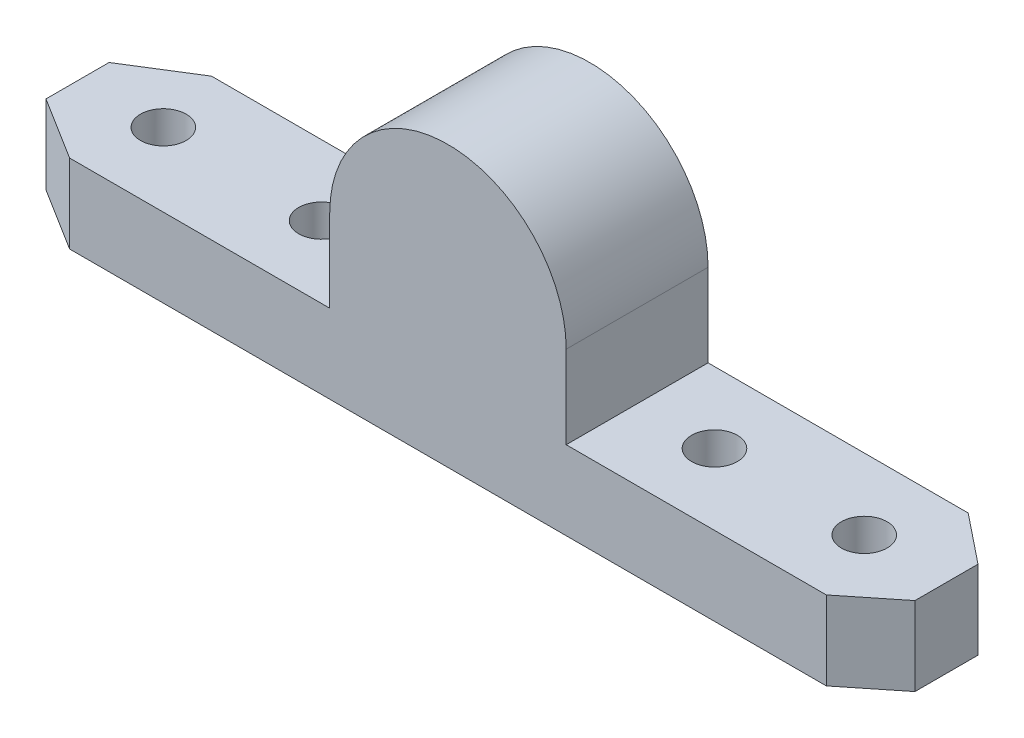
from build123d import *

# Parameters (mm, degrees)
DODANIE_WYCI_GNI_CIE1_DEPTH = 5
DODANIE_WYCI_GNI_CIE2_DEPTH = 9
SZKIC4_R                    = 1.45
WYTNIJ_WYCI_GNI_CIE1_DEPTH  = 6


with BuildPart() as part:
    # Szkic1 → Dodanie-wyciągnięcie1 (new body)
    with BuildSketch(Plane(origin=(0, 0, 0), x_dir=(1, 0, 0), z_dir=(0, 1, 0))):
        Polygon((24, 4.5), (27.122498999, 2), (27.122498999, -2), (24, -4.5), (-24, -4.5), (-28, -2), (-28, 2), (-24, 4.5), align=None)
    extrude(amount=DODANIE_WYCI_GNI_CIE1_DEPTH)

    # Szkic2 → Dodanie-wyciągnięcie2 (add)
    with BuildSketch(Plane.XY.offset(4.5)):
        with BuildLine():
            Line((-7.5, 5), (7.5, 5))
            Line((7.5, 5), (7.5, 10.25))
            ThreePointArc((7.5, 10.25), (0, 17.75), (-7.5, 10.25))
            Line((-7.5, 10.25), (-7.5, 5))
        make_face()
    extrude(amount=-DODANIE_WYCI_GNI_CIE2_DEPTH)

    # Szkic4 → Wytnij-wyciągnięcie1 (cut)
    with BuildSketch(Plane(origin=(0, 5, 0), x_dir=(1, 0, 0), z_dir=(0, 1, 0))):
        with Locations(Location((12.40562475, 0, 0), (0, 0, 270))):
            Circle(SZKIC4_R)
        with Locations(Location((21.90562475, 0, 0), (0, 0, 270))):
            Circle(SZKIC4_R)
        with Locations(Location((-12.57201541, 0.053033314, 0), (0, 0, 270))):
            Circle(SZKIC4_R)
        with Locations(Location((-22.71604623, 0.159099943, 0), (0, 0, 270))):
            Circle(SZKIC4_R)
    extrude(amount=-WYTNIJ_WYCI_GNI_CIE1_DEPTH, mode=Mode.SUBTRACT)


solid = part.part
